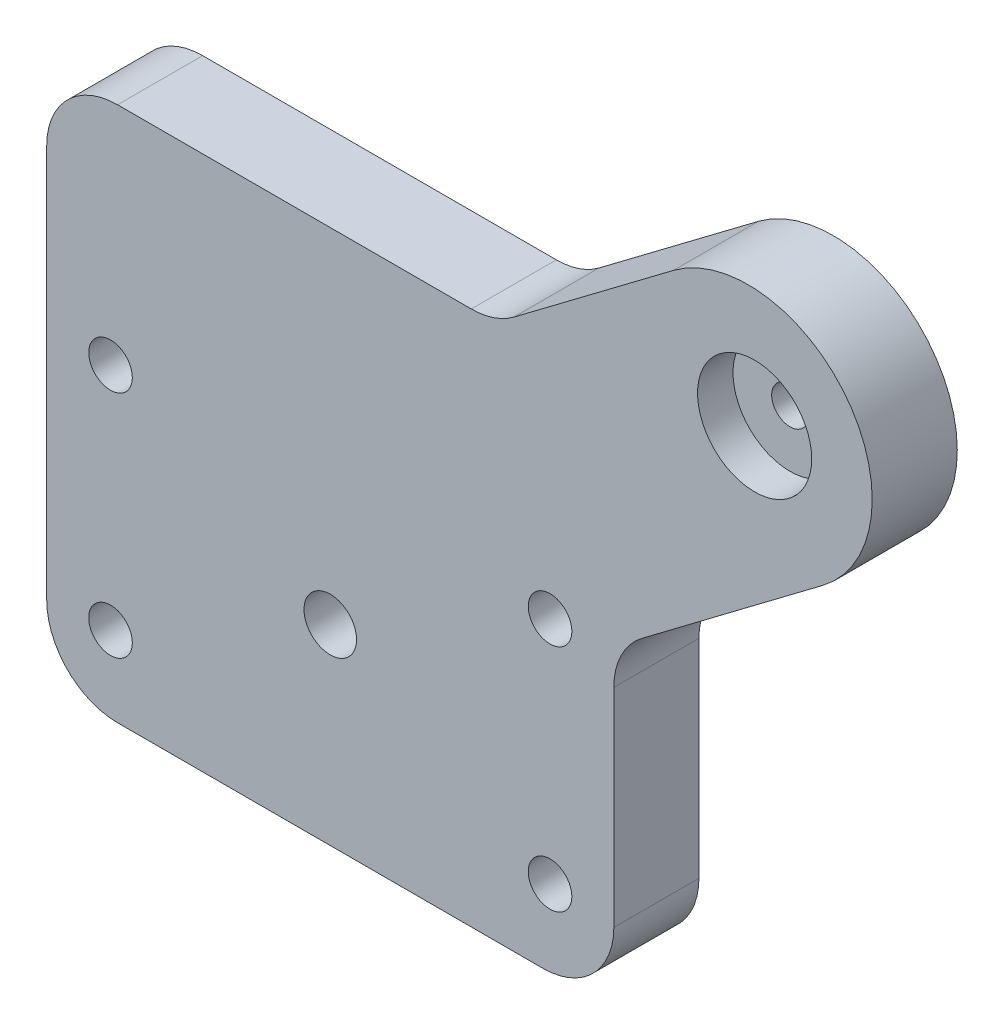
from build123d import *

# Parameters (mm, degrees)
SKETCH1_R              = 3.706733852
BOSS_EXTRUDE1_DEPTH    = 12
F_12_CLEARANCE_HOLE1_D = 6.15
FILLET1_R              = 10
SKETCH6_R              = 8.05
SKETCH6_R_2            = 2.6
CUT_EXTRUDE1_DEPTH     = 5
SKETCH6_2_R            = 2.6
CUT_EXTRUDE2_DEPTH     = 272.271439088


with BuildPart() as part:
    # Sketch1 → Boss-Extrude1 (new body)
    with BuildSketch(Plane.XY.offset(26)):
        with BuildLine():
            Line((48.415563176, 256.476121426), (23.233399504, 237.5))
            Line((23.233399504, 237.5), (-40, 237.5))
            Line((-40, 237.5), (-40, 162))
            Line((-40, 162), (40, 162))
            Line((40, 162), (40, 206.309791675))
            Line((40, 206.309791675), (69.479088987, 228.523878574))
            ThreePointArc((69.479088987, 228.523878574), (72.923447507, 253.031762905), (48.415563176, 256.476121426))
        make_face()
        with Locations((0, 189)):
            Circle(SKETCH1_R, mode=Mode.SUBTRACT)
    extrude(amount=-BOSS_EXTRUDE1_DEPTH)

    # #12 Clearance Hole1 (through all)
    with Locations(Plane.XY.offset(26)):
        with Locations((31, 172.8), (-31, 205.2), (-31, 172.8), (31, 205.2)):
            Hole(F_12_CLEARANCE_HOLE1_D / 2)

    # Fillet1
    fillet1_edges = [part.edges().sort_by_distance(p)[0] for p in [
        (40, 206.309791675, 20),
        (-40, 237.5, 20),
        (23.233399504, 237.5, 20),
        (-40, 162, 20),
        (40, 162, 20),
    ]]
    fillet(fillet1_edges, radius=FILLET1_R)

    # Sketch6 → Cut-Extrude1 (cut)
    with BuildSketch(Plane.XY.offset(26)):
        with Locations((59.857743265, 243.186048556)):
            Circle(SKETCH6_R)
        with Locations((59.857743265, 243.186048556)):
            Circle(SKETCH6_R_2, mode=Mode.SUBTRACT)
    extrude(amount=-CUT_EXTRUDE1_DEPTH, mode=Mode.SUBTRACT)

    # Sketch6<2> → Cut-Extrude2 (cut, through all)
    with BuildSketch(Plane.XY.offset(26)):
        with Locations((59.857743265, 243.186048556)):
            Circle(SKETCH6_2_R)
    extrude(amount=-CUT_EXTRUDE2_DEPTH, mode=Mode.SUBTRACT)


solid = part.part
